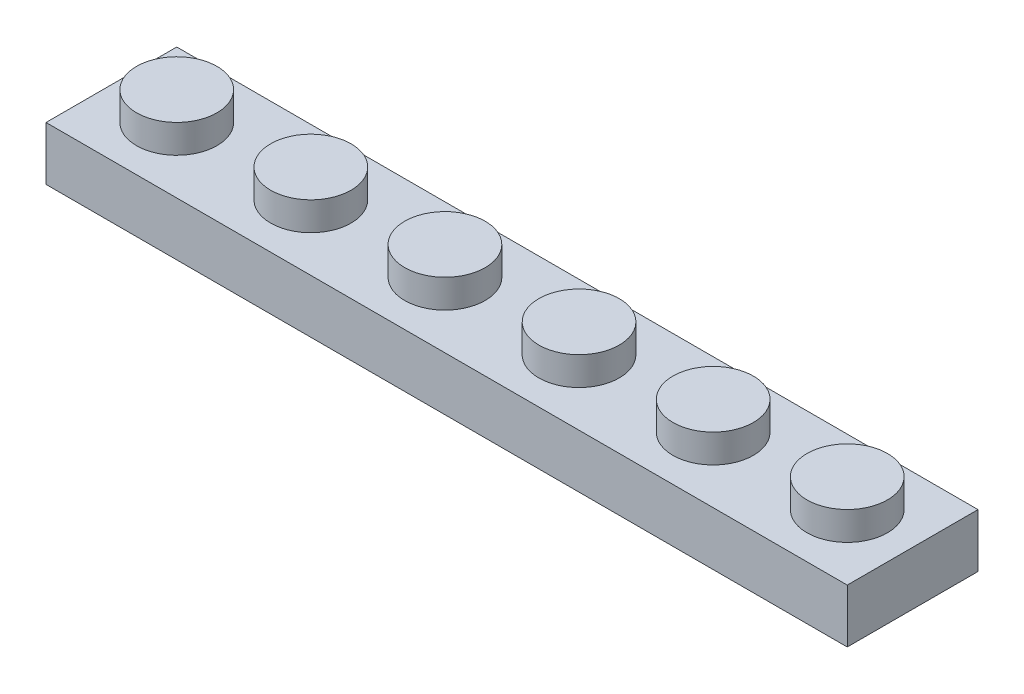
from build123d import *

# Parameters (mm, degrees)
SKETCH_1_W          = 47.8
SKETCH_1_H          = 7.8
EXTRUDE_1_DEPTH     = 3.2
SKETCH_2_R          = 2.4
EXTRUDE_2_DEPTH     = 1.7
SKETCH_3_R          = 2.5
CUT_EXTRUDE_1_DEPTH = 1.8


with BuildPart() as part:
    # Эскиз1 → Бобышка-Вытянуть1 (new body)
    with BuildSketch(Plane(origin=(0, 0, 0), x_dir=(1, 0, 0), z_dir=(0, 1, 0))):
        Rectangle(SKETCH_1_W, SKETCH_1_H)
    extrude(amount=EXTRUDE_1_DEPTH)

    # Эскиз2 → Бобышка-Вытянуть2 (add)
    with BuildSketch(Plane(origin=(0, 3.2, 0), x_dir=(1, 0, 0), z_dir=(0, 1, 0))):
        with Locations(Location((-20, 0, 0), (0, 0, 270))):
            Circle(SKETCH_2_R)
        with Locations(Location((-12, 0, 0), (0, 0, 270))):
            Circle(SKETCH_2_R)
        with Locations(Location((-4, 0, 0), (0, 0, 270))):
            Circle(SKETCH_2_R)
        with Locations(Location((4, 0, 0), (0, 0, 270))):
            Circle(SKETCH_2_R)
        with Locations(Location((12, 0, 0), (0, 0, 270))):
            Circle(SKETCH_2_R)
        with Locations(Location((20, 0, 0), (0, 0, 270))):
            Circle(SKETCH_2_R)
    extrude(amount=EXTRUDE_2_DEPTH)

    # Эскиз3 → Вырез-Вытянуть1 (cut)
    with BuildSketch(Plane.XZ):
        with Locations(Location((-20, 0, 0), (0, 0, 270))):
            Circle(SKETCH_3_R)
        with Locations(Location((-12, 0, 0), (0, 0, 270))):
            Circle(SKETCH_3_R)
        with Locations(Location((-4, 0, 0), (0, 0, 270))):
            Circle(SKETCH_3_R)
        with Locations(Location((4, 0, 0), (0, 0, 270))):
            Circle(SKETCH_3_R)
        with Locations(Location((12, 0, 0), (0, 0, 270))):
            Circle(SKETCH_3_R)
        with Locations(Location((20, 0, 0), (0, 0, 270))):
            Circle(SKETCH_3_R)
    extrude(amount=-CUT_EXTRUDE_1_DEPTH, mode=Mode.SUBTRACT)


solid = part.part
